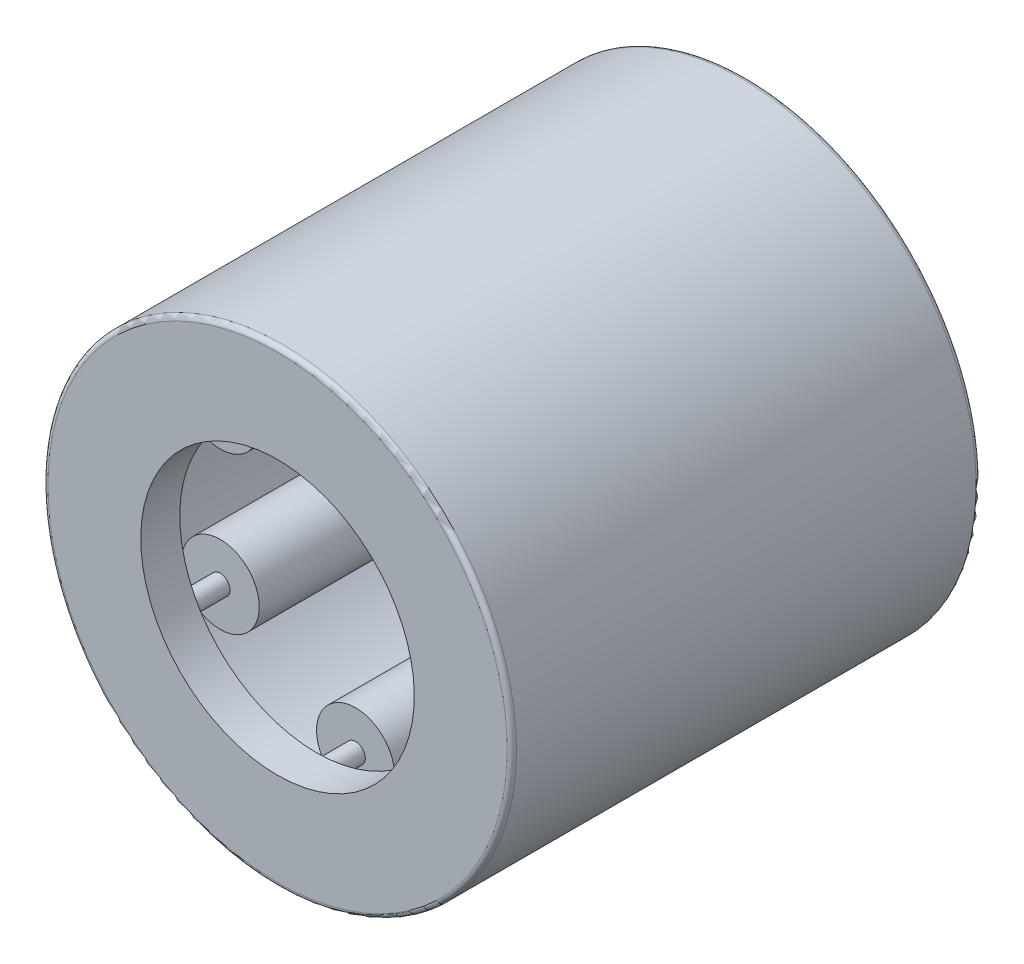
from build123d import *

# Parameters (mm, degrees)
SKETCH2_W         = 5.338
SKETCH2_H         = 0.499125
SKETCH3_W         = 6.669
SKETCH3_H         = 0.166375
CIRPATTERN1_COUNT = 6
CIRPATTERN1_ANGLE = 300
FILLET1_R         = 0.07993


with BuildPart() as part:
    # Sketch1 → Revolve1 (revolve)
    with BuildSketch(Plane(origin=(0, 0, 0), x_dir=(0, 0, -1), z_dir=(1, 0, 0)), mode=Mode.PRIVATE) as revolve1_sk:
        Polygon((-4, 3.9965), (4, 3.9965), (4, 2.33275), (3.3345, 2.33275), (3.3345, 3.331), (-3.3345, 3.331), (-3.3345, 2.33275), (-4, 2.33275), align=None)
    revolve(revolve1_sk.sketch.rotate(Axis((0, 0, 4), (0, 0, -1)), 180), axis=Axis((0, 0, 4), (0, 0, -1)))

    # Fillet1
    fillet1_edges = [part.edges().sort_by_distance(p)[0] for p in [
        (0, 3.9965, 4),
        (0, 3.9965, -4),
    ]]
    fillet(fillet1_edges, radius=FILLET1_R)


with BuildPart() as body_2:
    # Sketch2 → Revolve2 (revolve)
    with BuildSketch(Plane(origin=(0, 0, 0), x_dir=(0, 0, -1), z_dir=(1, 0, 0)), mode=Mode.PRIVATE) as revolve2_sk:
        with Locations((0, 3.0814375)):
            Rectangle(SKETCH2_W, SKETCH2_H)
    revolve(revolve2_sk.sketch.rotate(Axis((0, 2.6655, 2.669), (0, 0, -1)), 180), axis=Axis((0, 2.6655, 2.669), (0, 0, -1)))


with BuildPart() as body_3:
    # Sketch3 → Revolve3 (revolve)
    with BuildSketch(Plane(origin=(0, 0, 0), x_dir=(0, 0, -1), z_dir=(1, 0, 0))):
        with Locations((0, 2.7486875)):
            Rectangle(SKETCH3_W, SKETCH3_H)
    revolve(axis=Axis((0, 2.6655, 3.3345), (0, 0, -1)))


with BuildPart() as cirpattern1_1:
    # CirPattern1: pattern copy
    add(body_3.part.rotate(Axis((0, 0, -4), (0, 0, 1)), 1 * CIRPATTERN1_ANGLE / (CIRPATTERN1_COUNT - 1)))


with BuildPart() as cirpattern1_2:
    # CirPattern1: pattern copy
    add(body_3.part.rotate(Axis((0, 0, -4), (0, 0, 1)), 2 * CIRPATTERN1_ANGLE / (CIRPATTERN1_COUNT - 1)))


with BuildPart() as cirpattern1_3:
    # CirPattern1: pattern copy
    add(body_3.part.rotate(Axis((0, 0, -4), (0, 0, 1)), 3 * CIRPATTERN1_ANGLE / (CIRPATTERN1_COUNT - 1)))


with BuildPart() as cirpattern1_4:
    # CirPattern1: pattern copy
    add(body_3.part.rotate(Axis((0, 0, -4), (0, 0, 1)), 4 * CIRPATTERN1_ANGLE / (CIRPATTERN1_COUNT - 1)))


with BuildPart() as cirpattern1_5:
    # CirPattern1: pattern copy
    add(body_3.part.rotate(Axis((0, 0, -4), (0, 0, 1)), 5 * CIRPATTERN1_ANGLE / (CIRPATTERN1_COUNT - 1)))


with BuildPart() as cirpattern1_6:
    # CirPattern1: pattern copy
    add(body_2.part.rotate(Axis((0, 0, -4), (0, 0, 1)), 1 * CIRPATTERN1_ANGLE / (CIRPATTERN1_COUNT - 1)))


with BuildPart() as cirpattern1_7:
    # CirPattern1: pattern copy
    add(body_2.part.rotate(Axis((0, 0, -4), (0, 0, 1)), 2 * CIRPATTERN1_ANGLE / (CIRPATTERN1_COUNT - 1)))


with BuildPart() as cirpattern1_8:
    # CirPattern1: pattern copy
    add(body_2.part.rotate(Axis((0, 0, -4), (0, 0, 1)), 3 * CIRPATTERN1_ANGLE / (CIRPATTERN1_COUNT - 1)))


with BuildPart() as cirpattern1_9:
    # CirPattern1: pattern copy
    add(body_2.part.rotate(Axis((0, 0, -4), (0, 0, 1)), 4 * CIRPATTERN1_ANGLE / (CIRPATTERN1_COUNT - 1)))


with BuildPart() as cirpattern1_10:
    # CirPattern1: pattern copy
    add(body_2.part.rotate(Axis((0, 0, -4), (0, 0, 1)), 5 * CIRPATTERN1_ANGLE / (CIRPATTERN1_COUNT - 1)))


solid = Compound([part.part, body_2.part, body_3.part, cirpattern1_1.part, cirpattern1_2.part, cirpattern1_3.part, cirpattern1_4.part, cirpattern1_5.part, cirpattern1_6.part, cirpattern1_7.part, cirpattern1_8.part, cirpattern1_9.part, cirpattern1_10.part])
